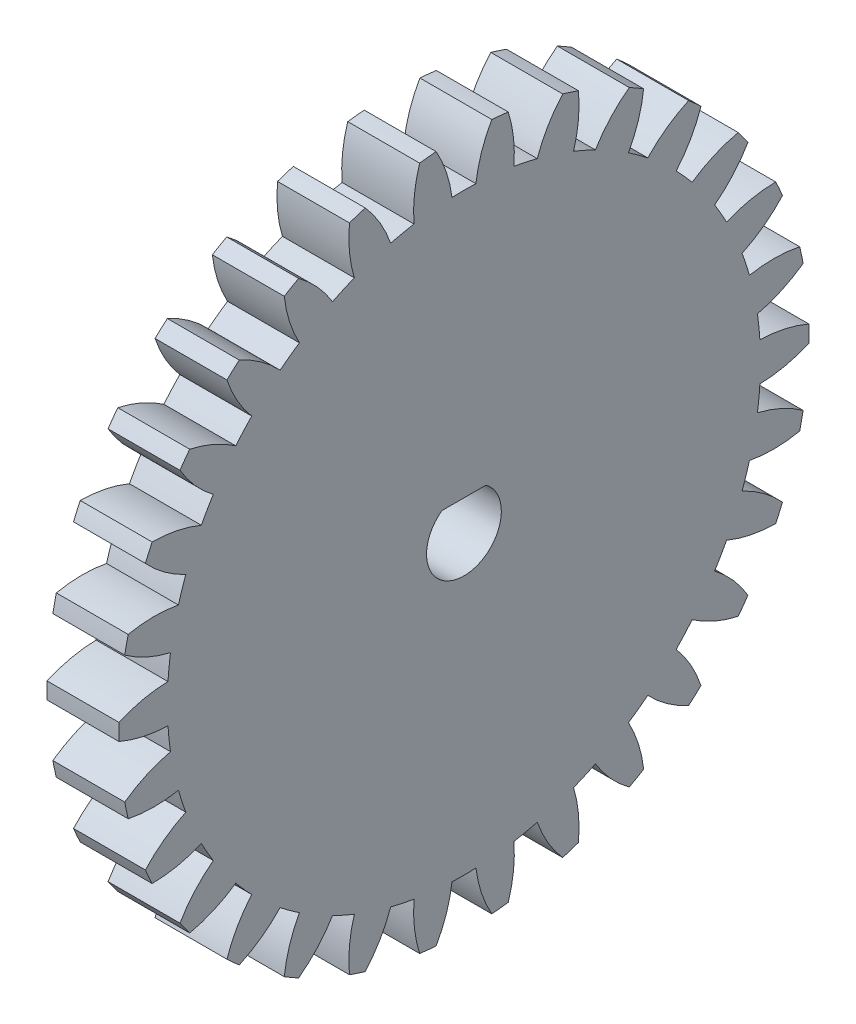
from build123d import *

# Parameters (mm, degrees)
BASPROSKE_W                   = 5
BASPROSKE_H                   = 24
TOOTHCUT_DEPTH                = 35.307433597
TEETHCUTS_COUNT               = 30
TEETHCUTS_ANGLE               = 348
BORSKE_R                      = 1
BORE_DEPTH                    = 50.0000508
TAGLIO_ESTRUSIONE1_DEPTH      = 35.252832836
TAGLIO_ESTRUSIONE1_DEPTH_BACK = 35.252832836


with BuildPart() as part:
    # BasProSke → Base-Revolve (revolve)
    with BuildSketch(Plane(origin=(0, 0, 0), x_dir=(1, 0, 0), z_dir=(0, 1, 0)), mode=Mode.PRIVATE) as base_revolve_sk:
        with Locations((2.5, 12)):
            Rectangle(BASPROSKE_W, BASPROSKE_H)
    revolve(base_revolve_sk.sketch.rotate(Axis((-10, 0, 0), (1, 0, 0)), 180), axis=Axis((-10, 0, 0), (1, 0, 0)))

    # TooCutSke → ToothCut (cut, through all)
    with BuildSketch(Plane(origin=(0, 0, 0), x_dir=(0, 0, -1), z_dir=(1, 0, 0))):
        with BuildLine():
            ThreePointArc((0.830875803, 20.607256523), (0, 20.624), (-0.830875803, 20.607256523))
            ThreePointArc((-0.830875803, 20.607256523), (-1.224899184, 22.331948106), (-1.948690982, 23.946240803))
            ThreePointArc((-1.948690982, 23.946240803), (0, 24.0254), (1.948690982, 23.946240803))
            ThreePointArc((1.948690982, 23.946240803), (1.224899184, 22.331948106), (0.830875803, 20.607256523))
        make_face()
    toothcut = extrude(amount=TOOTHCUT_DEPTH, mode=Mode.SUBTRACT)

    # TeethCuts: ToothCut ×30 about axis
    teethcuts_axis = Axis((-10, 0, 0), (1, 0, 0))
    for i in range(1, TEETHCUTS_COUNT):
        add(toothcut.rotate(teethcuts_axis, i * TEETHCUTS_ANGLE / (TEETHCUTS_COUNT - 1)), mode=Mode.SUBTRACT)

    # BorSke → Bore (cut, symmetric)
    with BuildSketch(Plane(origin=(0, 0, 0), x_dir=(0, 0, -1), z_dir=(1, 0, 0))):
        with Locations(Location((0, 0, 0), (0, 0, 180))):
            Circle(BORSKE_R)
    extrude(amount=BORE_DEPTH, both=True, mode=Mode.SUBTRACT)

    # Schizzo2 → Taglio-Estrusione1 (cut, two sides: drawn at the far end of the back side and taken through both)
    with BuildSketch(Plane.ZY.offset(-TAGLIO_ESTRUSIONE1_DEPTH_BACK)):
        with BuildLine():
            Line((1.532970972, 2.1), (-1.532970972, 2.1))
            ThreePointArc((-1.532970972, 2.1), (-1.177768117, -2.317943542), (2.6, 0))
            ThreePointArc((2.6, 0), (2.317943542, 1.177768117), (1.532970972, 2.1))
        make_face()
    extrude(amount=TAGLIO_ESTRUSIONE1_DEPTH + TAGLIO_ESTRUSIONE1_DEPTH_BACK, mode=Mode.SUBTRACT)


solid = part.part
